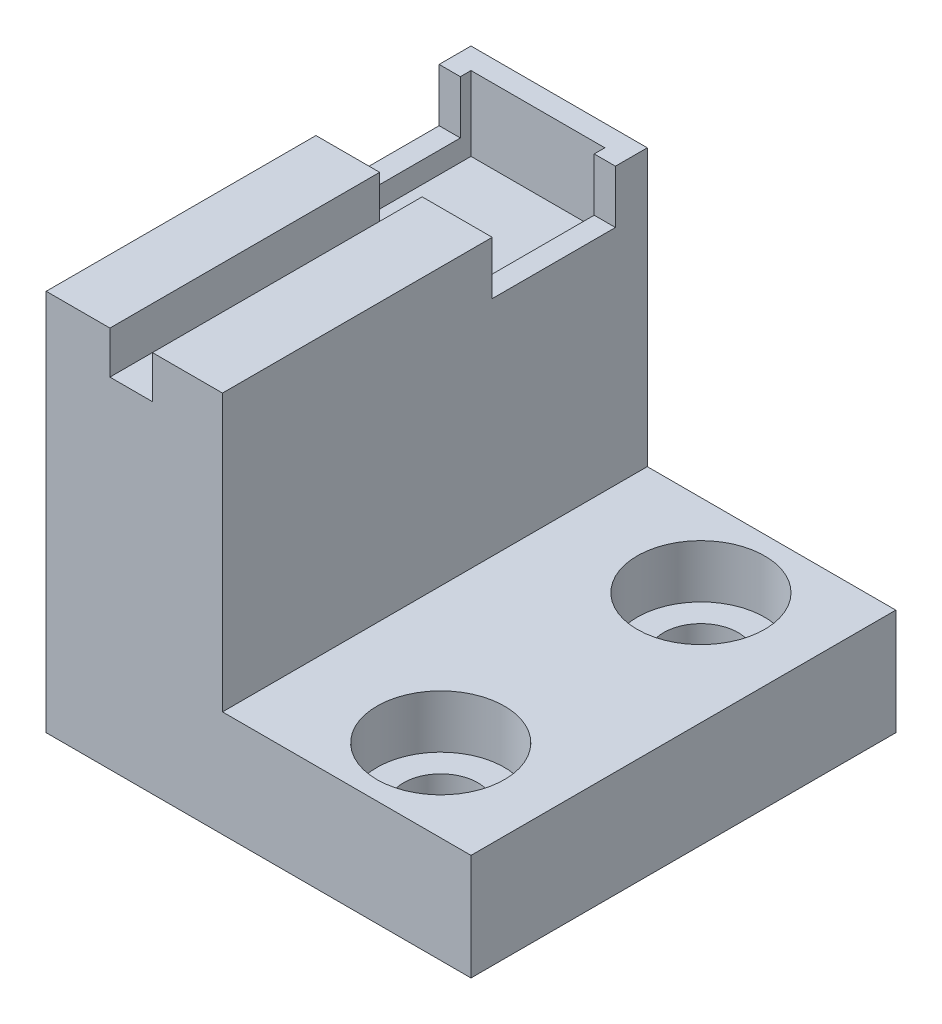
from build123d import *

# Parameters (mm, degrees)
SKETCH_1_W          = 40
SKETCH_1_H          = 40
EXTRUDE_1_DEPTH     = 36
SKETCH_2_W          = 12.6
SKETCH_2_H          = 12.6
CUT_EXTRUDE_1_DEPTH = 7
SKETCH_3_W          = 2
SKETCH_3_H          = 11.6
CUT_EXTRUDE_2_DEPTH = 5
SKETCH_4_W          = 4
SKETCH_4_H          = 25.4
CUT_EXTRUDE_3_DEPTH = 4
SKETCH_5_W          = 23.4
SKETCH_5_H          = 40
CUT_EXTRUDE_6_DEPTH = 26
SKETCH_6_R          = 6
CUT_EXTRUDE_7_DEPTH = 5
SKETCH_7_R          = 3.5
CUT_EXTRUDE_8_DEPTH = 39.418745425


with BuildPart() as part:
    # 草图1 → 凸台-拉伸1 (new body)
    with BuildSketch(Plane(origin=(0, 0, 0), x_dir=(1, 0, 0), z_dir=(0, 1, 0))):
        Rectangle(SKETCH_1_W, SKETCH_1_H)
    extrude(amount=EXTRUDE_1_DEPTH)

    # 草图2 → 切除-拉伸1 (cut)
    with BuildSketch(Plane(origin=(0, 36, 0), x_dir=(1, 0, 0), z_dir=(0, 1, 0))):
        with Locations((-11.7, 11.7)):
            Rectangle(SKETCH_2_W, SKETCH_2_H)
    extrude(amount=-CUT_EXTRUDE_1_DEPTH, mode=Mode.SUBTRACT)

    # 草图3 → 切除-拉伸2 (cut)
    with BuildSketch(Plane(origin=(0, 36, 0), x_dir=(1, 0, 0), z_dir=(0, 1, 0))):
        with Locations((-19, 11.2)):
            Rectangle(SKETCH_3_W, SKETCH_3_H)
        with Locations((-4.4, 11.2)):
            Rectangle(SKETCH_3_W, SKETCH_3_H)
    extrude(amount=-CUT_EXTRUDE_2_DEPTH, mode=Mode.SUBTRACT)

    # 草图4 → 切除-拉伸3 (cut)
    with BuildSketch(Plane(origin=(0, 36, 0), x_dir=(1, 0, 0), z_dir=(0, 1, 0))):
        with Locations((-12, -7.3)):
            Rectangle(SKETCH_4_W, SKETCH_4_H)
    extrude(amount=-CUT_EXTRUDE_3_DEPTH, mode=Mode.SUBTRACT)

    # 草图5 → 切除-拉伸6 (cut)
    with BuildSketch(Plane(origin=(0, 36, 0), x_dir=(1, 0, 0), z_dir=(0, 1, 0))):
        with Locations((8.3, 0)):
            Rectangle(SKETCH_5_W, SKETCH_5_H)
    extrude(amount=-CUT_EXTRUDE_6_DEPTH, mode=Mode.SUBTRACT)

    # 草图6 → 切除-拉伸7 (cut)
    with BuildSketch(Plane(origin=(0, 10, 0), x_dir=(1, 0, 0), z_dir=(0, 1, 0))):
        with Locations(Location((9.4, 12.25, 0), (0, 0, 270))):
            Circle(SKETCH_6_R)
        with Locations(Location((9.4, -12.25, 0), (0, 0, 270))):
            Circle(SKETCH_6_R)
    extrude(amount=-CUT_EXTRUDE_7_DEPTH, mode=Mode.SUBTRACT)

    # 草图7 → 切除-拉伸8 (cut, through all)
    with BuildSketch(Plane(origin=(0, 10, 0), x_dir=(1, 0, 0), z_dir=(0, 1, 0))):
        with Locations(Location((9.4, 12.25, 0), (0, 0, 270))):
            Circle(SKETCH_7_R)
        with Locations(Location((9.4, -12.25, 0), (0, 0, 270))):
            Circle(SKETCH_7_R)
    extrude(amount=-CUT_EXTRUDE_8_DEPTH, mode=Mode.SUBTRACT)


solid = part.part
